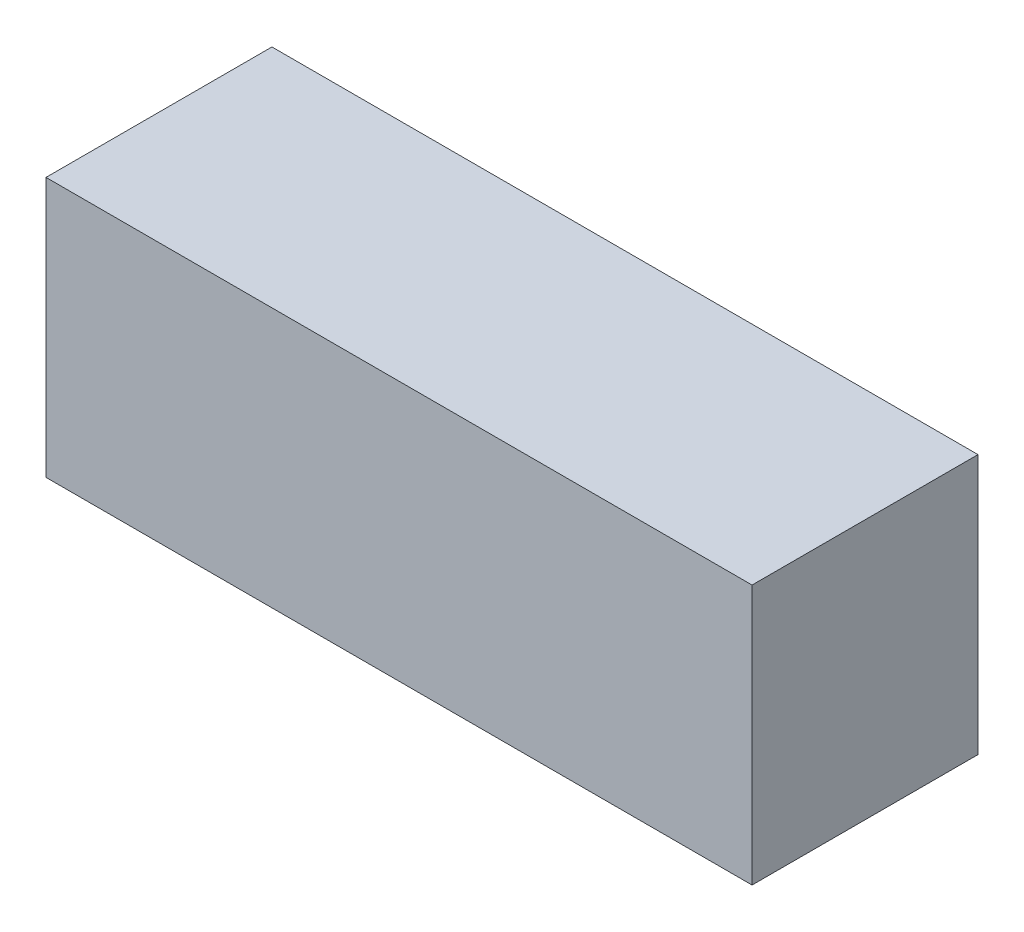
from build123d import *

# Parameters (mm, degrees)
SKETCH1_W           = 12.5
SKETCH1_H           = 4.6
BOSS_EXTRUDE1_DEPTH = 4


with BuildPart() as part:
    # Sketch1 → Boss-Extrude1 (new body)
    with BuildSketch(Plane.XY):
        with Locations((-97.610792913, -6.3)):
            Rectangle(SKETCH1_W, SKETCH1_H)
    extrude(amount=-BOSS_EXTRUDE1_DEPTH)


solid = part.part
